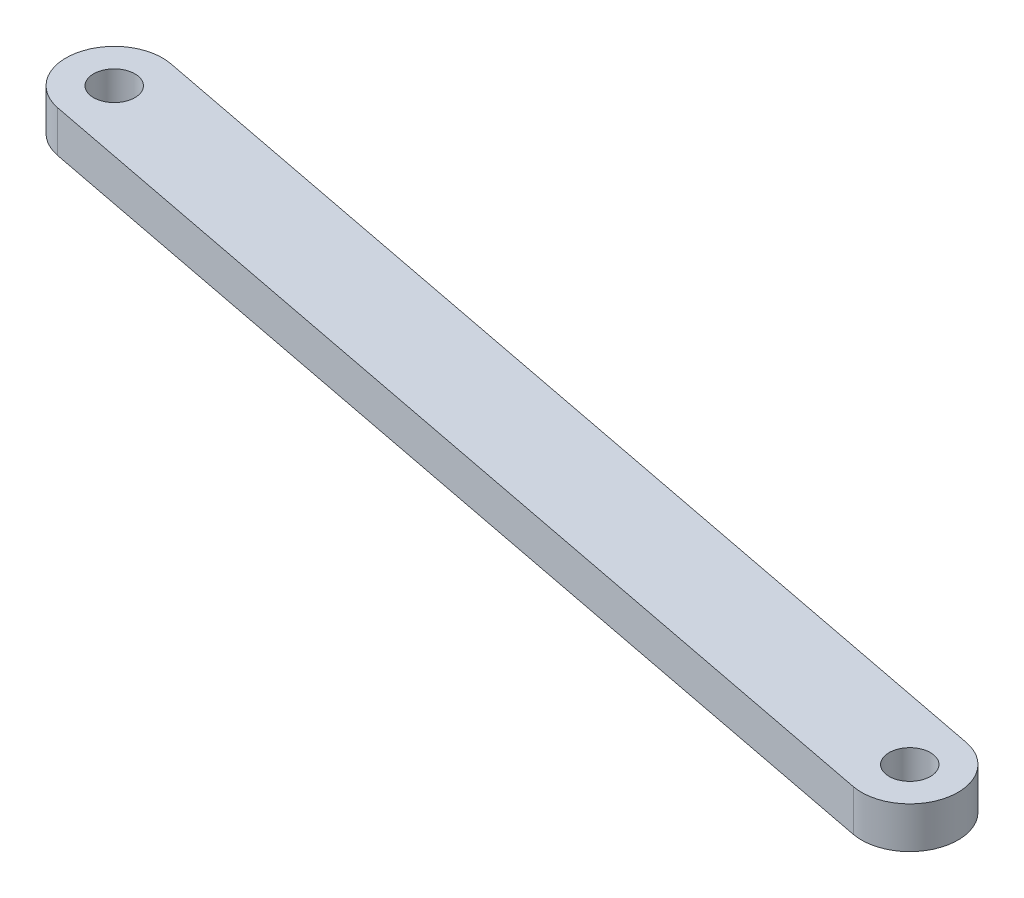
from build123d import *

# Parameters (mm, degrees)
SKETCH2_R           = 1.5
BOSS_EXTRUDE2_DEPTH = 3


with BuildPart() as part:
    # Sketch2 → Boss-Extrude2 (new body)
    # profile 1 of 2: a face of its own
    with BuildSketch(Plane(origin=(0, 84, 0), x_dir=(1, 0, 0), z_dir=(0, 1, 0))):
        with BuildLine():
            ThreePointArc((-6.349779829, 90.729255992), (-8.48155795, 87.141170391), (-5.66275018, 84.063320655))
            ThreePointArc((-5.66275018, 84.063320655), (-4.641171279, 84.018442382), (-3.65022139, 84.270743452))
            ThreePointArc((-3.65022139, 84.270743452), (-1.51844327, 87.858829053), (-4.33725104, 90.936678789))
            Line((-4.33725104, 90.936678789), (-5.374827195, 91.136771127))
            Line((-5.374827195, 91.136771127), (-6.349779829, 90.729255992))
        make_face()
        with Locations(Location((-5.00000061, 87.499999722, 0), (0, 0, 270))):
            Circle(SKETCH2_R, mode=Mode.SUBTRACT)
    # profile 2 of 2: a face of its own
    with BuildSketch(Plane(origin=(0, 84, 0), x_dir=(1, 0, 0), z_dir=(0, 1, 0))):
        with BuildLine():
            Line((-77.167393969, 97.852700174), (-5.66275018, 84.063320655))
            ThreePointArc((-5.66275018, 84.063320655), (-8.48155795, 87.141170391), (-6.349779829, 90.729255992))
            Line((-6.349779829, 90.729255992), (-5.374827195, 91.136771127))
            Line((-5.374827195, 91.136771127), (-75.841894829, 104.726058307))
            ThreePointArc((-75.841894829, 104.726058307), (-79.941323466, 101.952128811), (-77.167393969, 97.852700174))
        make_face()
        with Locations(Location((-76.504644399, 101.28937924, 0), (0, 0, 270))):
            Circle(SKETCH2_R, mode=Mode.SUBTRACT)
    extrude(amount=BOSS_EXTRUDE2_DEPTH)


solid = part.part
